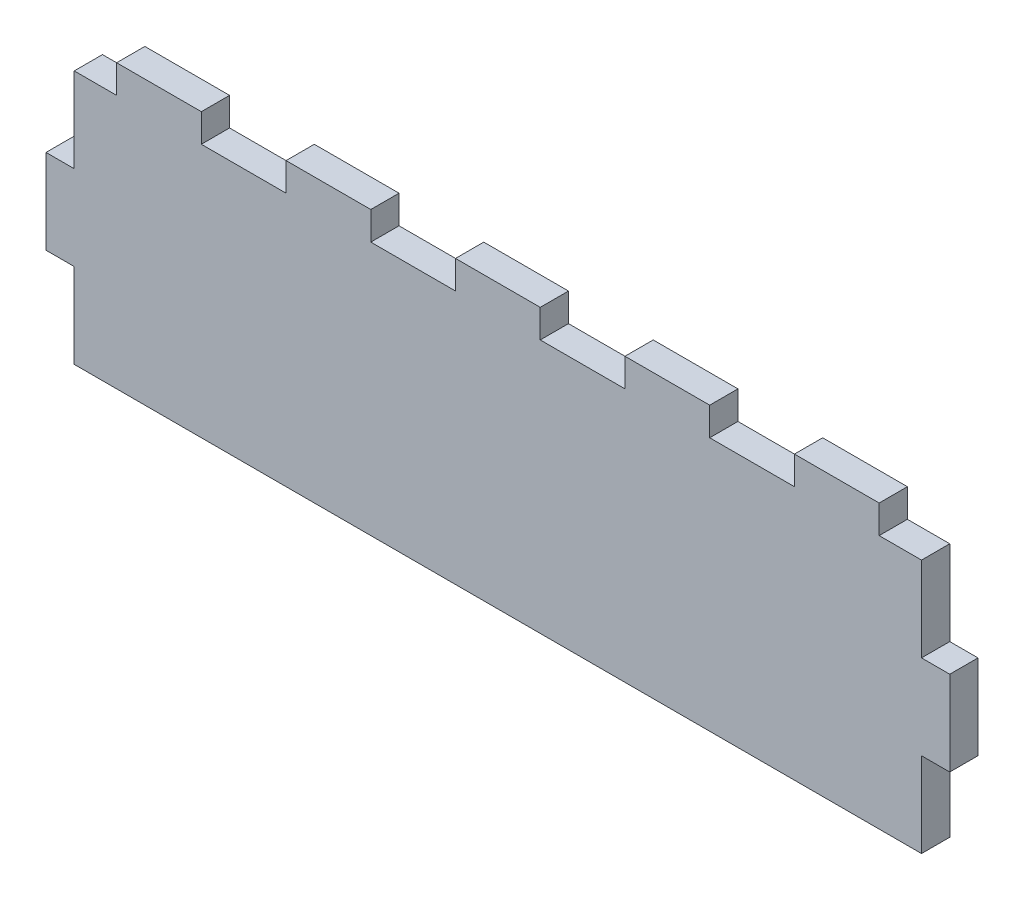
from build123d import *

# Parameters (mm, degrees)
SKETCH1_W           = 203.2
SKETCH1_H           = 63.5
BOSS_EXTRUDE1_DEPTH = 3.175
SKETCH2_W           = 15.875
SKETCH2_H           = 6.35
CUT_EXTRUDE1_DEPTH  = 107.634633211
SKETCH3_W           = 19.05
SKETCH3_H           = 6.35
CUT_EXTRUDE2_DEPTH  = 107.634633211
LPATTERN1_COUNT     = 4
LPATTERN1_PITCH     = 38.1
SKETCH4_W           = 6.35
SKETCH4_H           = 19.05
CUT_EXTRUDE3_DEPTH  = 107.634633211


with BuildPart() as part:
    # Sketch1 → Boss-Extrude1 (new, symmetric)
    with BuildSketch(Plane.XY):
        Rectangle(SKETCH1_W, SKETCH1_H)
    extrude(amount=BOSS_EXTRUDE1_DEPTH, both=True)

    # Sketch2 → Cut-Extrude1 (cut, through all)
    with BuildSketch(Plane.XY.offset(3.175)):
        with Locations((-93.6625, 28.575)):
            Rectangle(SKETCH2_W, SKETCH2_H)
    cut_extrude1 = extrude(amount=-CUT_EXTRUDE1_DEPTH, mode=Mode.SUBTRACT)

    # Mirror1: Cut-Extrude1 across plane
    add(cut_extrude1.mirror(Plane(origin=(0, 0, 0), x_dir=(0, 0, 1), z_dir=(1, 0, 0))), mode=Mode.SUBTRACT)

    # Sketch3 → Cut-Extrude2 (cut, through all)
    with BuildSketch(Plane.XY.offset(3.175)):
        with Locations((-57.15, 28.575)):
            Rectangle(SKETCH3_W, SKETCH3_H)
    cut_extrude2 = extrude(amount=-CUT_EXTRUDE2_DEPTH, mode=Mode.SUBTRACT)

    # LPattern1: Cut-Extrude2 ×4
    with Locations(*[(i * LPATTERN1_PITCH, 0, 0) for i in range(1, LPATTERN1_COUNT)]):
        add(cut_extrude2, mode=Mode.SUBTRACT)

    # Sketch4 → Cut-Extrude3 (cut, through all)
    with BuildSketch(Plane.XY.offset(3.175)):
        with Locations((-98.425, 15.875)):
            Rectangle(SKETCH4_W, SKETCH4_H)
        with Locations((-98.425, -22.225)):
            Rectangle(SKETCH4_W, SKETCH4_H)
    cut_extrude3 = extrude(amount=-CUT_EXTRUDE3_DEPTH, mode=Mode.SUBTRACT)

    # Mirror2: Cut-Extrude3 across plane
    add(cut_extrude3.mirror(Plane(origin=(0, 0, 0), x_dir=(0, 0, 1), z_dir=(1, 0, 0))), mode=Mode.SUBTRACT)


solid = part.part
